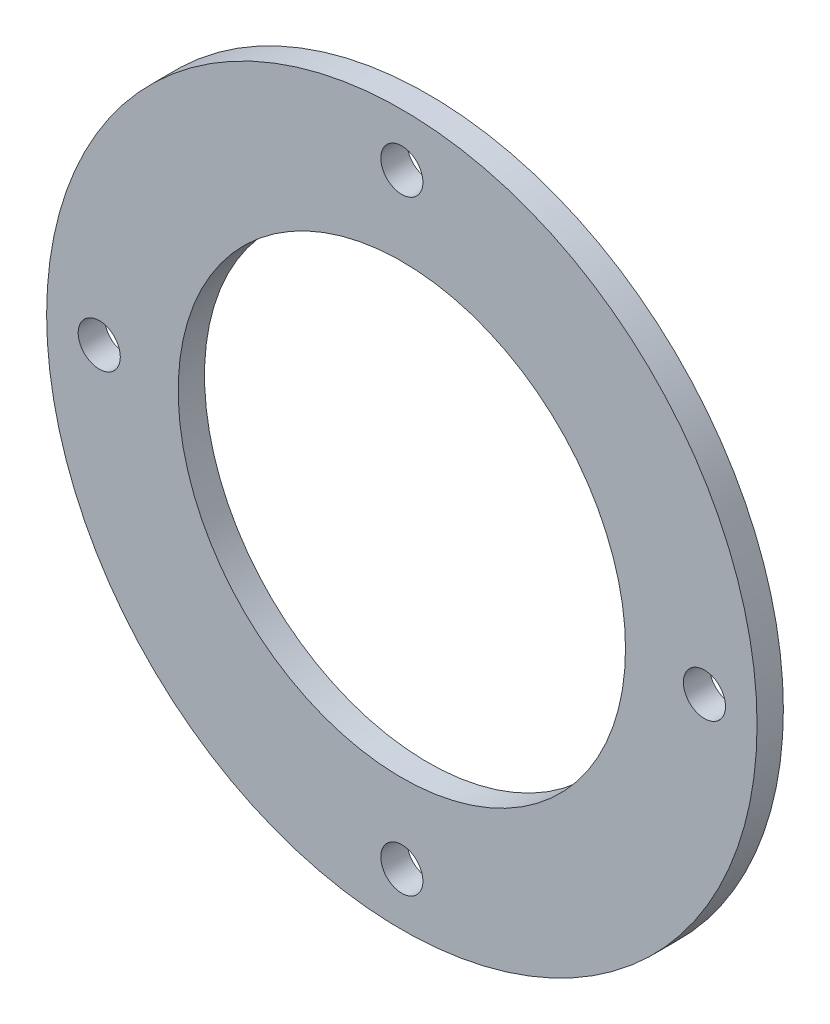
from build123d import *

# Parameters (mm, degrees)
SKETCH_1_R      = 27
SKETCH_1_R_2    = 17
SKETCH_1_R_3    = 1.6
EXTRUDE_1_DEPTH = 2


with BuildPart() as part:
    # 草图1 → 凸台-拉伸1 (new body)
    with BuildSketch(Plane.XY):
        Circle(SKETCH_1_R)
        Circle(SKETCH_1_R_2, mode=Mode.SUBTRACT)
        with Locations((0, 23)):
            Circle(SKETCH_1_R_3, mode=Mode.SUBTRACT)
        with Locations((23, 0)):
            Circle(SKETCH_1_R_3, mode=Mode.SUBTRACT)
        with Locations((0, -23)):
            Circle(SKETCH_1_R_3, mode=Mode.SUBTRACT)
        with Locations((-23, 0)):
            Circle(SKETCH_1_R_3, mode=Mode.SUBTRACT)
    extrude(amount=EXTRUDE_1_DEPTH)


solid = part.part
